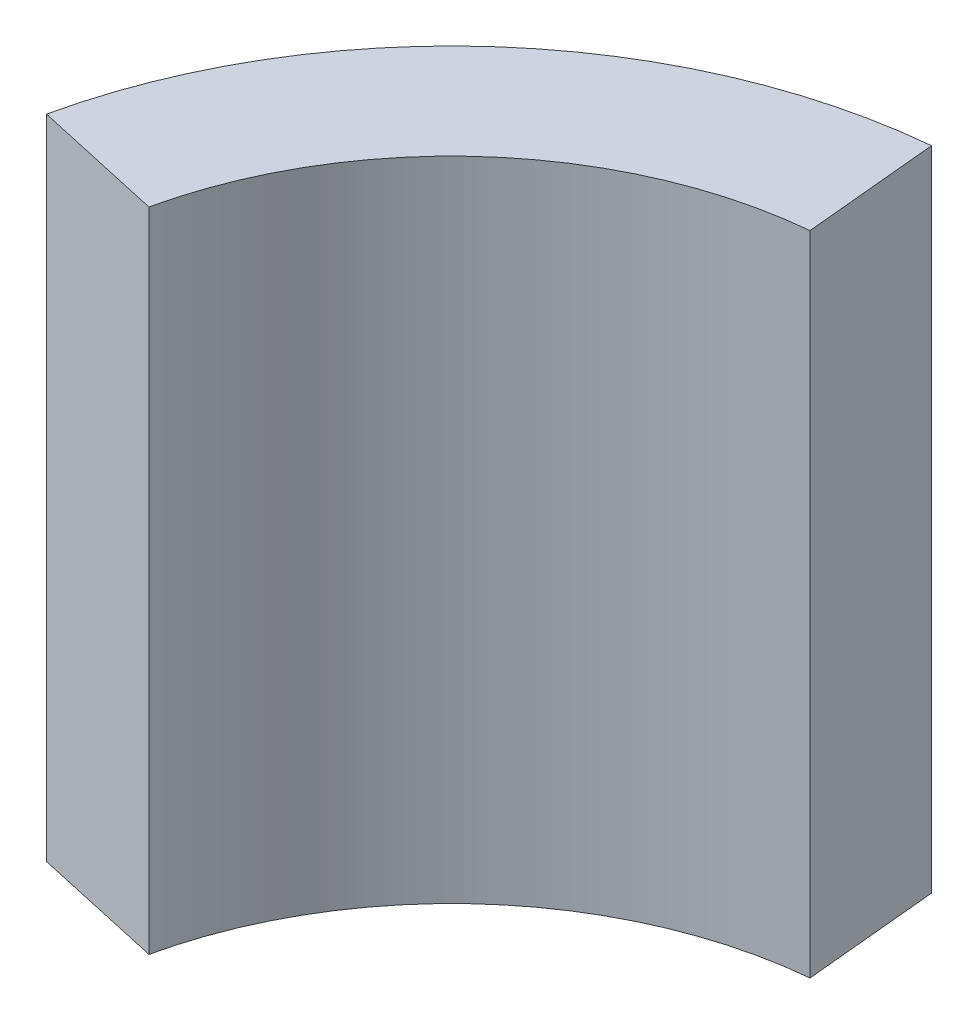
from build123d import *

# Parameters (mm, degrees)
BOSS_EXTRUDE1_DEPTH = 48


with BuildPart() as part:
    # Sketch1 → Boss-Extrude1 (new body)
    with BuildSketch(Plane(origin=(0, 0, 0), x_dir=(0.9999530758491465, 0, -0.009687419668383268), z_dir=(0, 1, 0))):
        with BuildLine():
            ThreePointArc((-57.175974077, 9.055853255), (-47.750827482, 24.696141005), (-30.928777925, 31.80041))
            Line((-30.928777925, 31.80041), (-31.779442162, 41.764134649))
            ThreePointArc((-31.779442162, 41.764134649), (-54.299198775, 32.253818326), (-66.917111166, 11.316439279))
            Line((-66.917111166, 11.316439279), (-57.175974077, 9.055853255))
        make_face()
    extrude(amount=BOSS_EXTRUDE1_DEPTH)


solid = part.part
